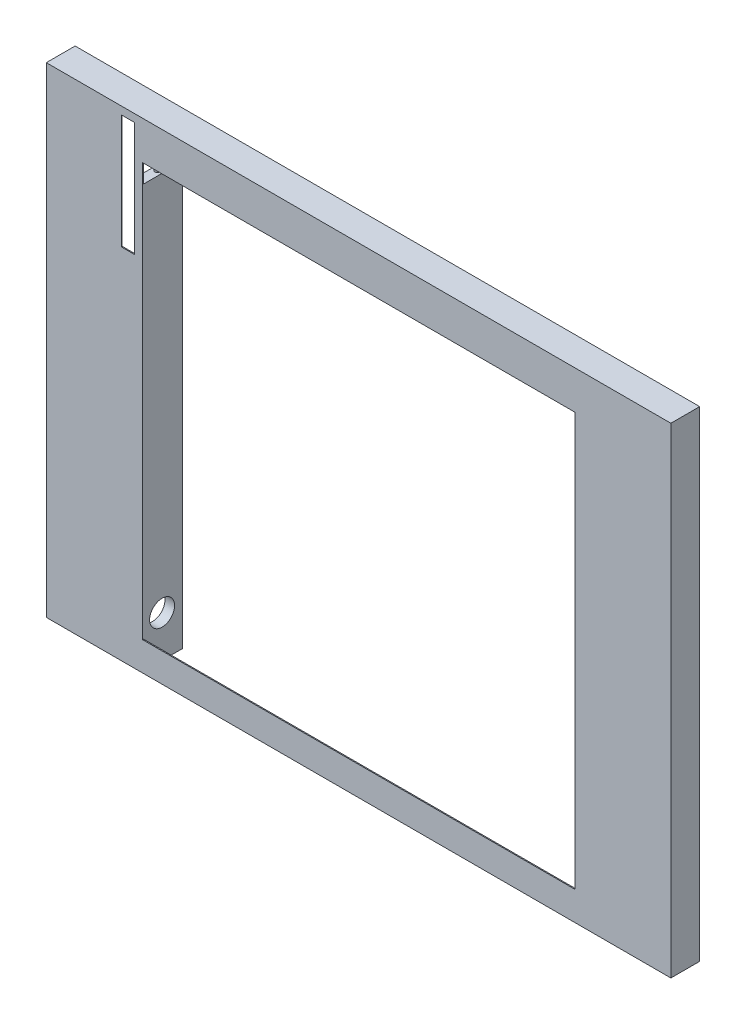
from build123d import *

# Parameters (mm, degrees)
SKETCH1_W           = 650
SKETCH1_H           = 500
SKETCH1_W_2         = 450
SKETCH1_H_2         = 420
BOSS_EXTRUDE1_DEPTH = 15
SHELL1_T            = -1
SKETCH3_W           = 450
SKETCH3_H           = 10
CUT_EXTRUDE1_DEPTH  = 20
SKETCH4_W           = 10
SKETCH4_H           = 439
BOSS_EXTRUDE2_DEPTH = 41
SKETCH5_R           = 13
CUT_EXTRUDE2_DEPTH  = 470
SKETCH6_R           = 2.5
BOSS_EXTRUDE3_DEPTH = 50
SKETCH7_W           = 14
SKETCH7_H           = 119
CUT_EXTRUDE3_DEPTH  = 5


with BuildPart() as part:
    # Sketch1 → Boss-Extrude1 (new, symmetric)
    with BuildSketch(Plane.XY):
        Rectangle(SKETCH1_W, SKETCH1_H)
        Rectangle(SKETCH1_W_2, SKETCH1_H_2, mode=Mode.SUBTRACT)
    extrude(amount=BOSS_EXTRUDE1_DEPTH, both=True)

    # Shell1
    shell1_openings = [part.faces().sort_by_distance(p)[0] for p in [
        (0, -241.799390267, -15),
        (-225, 0, 0),
        (0, -210, 0),
        (225, 0, 0),
        (0, 210, 0),
    ]]
    offset(amount=SHELL1_T, openings=shell1_openings, kind=Kind.INTERSECTION)

    # Sketch3 → Cut-Extrude1 (cut, symmetric)
    with BuildSketch(Plane.XY):
        with Locations((0, -215)):
            Rectangle(SKETCH3_W, SKETCH3_H)
    extrude(amount=CUT_EXTRUDE1_DEPTH, both=True, mode=Mode.SUBTRACT)

    # Sketch4 → Boss-Extrude2 (add)
    with BuildSketch(Plane(origin=(0, 0, 14), x_dir=(-1, 0, 0), z_dir=(0, 0, -1))):
        with Locations((230, -29.5)):
            Rectangle(SKETCH4_W, SKETCH4_H)
    boss_extrude2 = extrude(amount=BOSS_EXTRUDE2_DEPTH)

    # Mirror1: Boss-Extrude2 across plane
    add(boss_extrude2.mirror(Plane(origin=(0, 0, 0), x_dir=(0, 0, 1), z_dir=(1, 0, 0))))

    # Sketch5 → Cut-Extrude2 (cut)
    with BuildSketch(Plane.ZY.offset(235)):
        with Locations((-5.5, -206)):
            Circle(SKETCH5_R)
    extrude(amount=-CUT_EXTRUDE2_DEPTH, mode=Mode.SUBTRACT)

    # Sketch6 → Boss-Extrude3 (add)
    with BuildSketch(Plane(origin=(0, 190, 0), x_dir=(1, 0, 0), z_dir=(0, 1, 0))):
        with Locations(Location((230, 5.5, 0), (0, 0, 180))):
            Circle(SKETCH6_R)
    boss_extrude3 = extrude(amount=BOSS_EXTRUDE3_DEPTH)

    # Mirror2: Boss-Extrude3 across plane
    add(boss_extrude3.mirror(Plane(origin=(0, 0, 0), x_dir=(0, 0, 1), z_dir=(1, 0, 0))))

    # Sketch7 → Cut-Extrude3 (cut)
    with BuildSketch(Plane.XY.offset(15)):
        with Locations((-240, 182.5)):
            Rectangle(SKETCH7_W, SKETCH7_H)
    extrude(amount=-CUT_EXTRUDE3_DEPTH, mode=Mode.SUBTRACT)


solid = part.part
